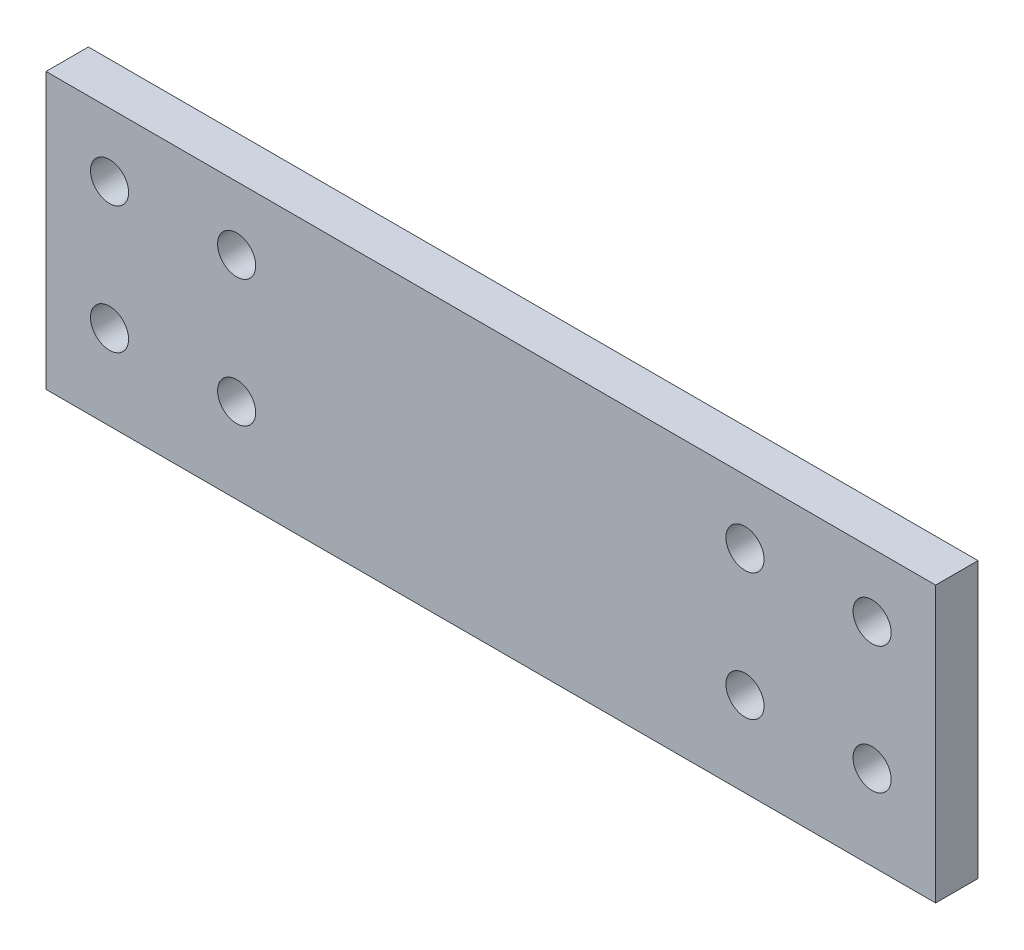
from build123d import *

# Parameters (mm, degrees)
SKETCH1_W           = 210
SKETCH1_H           = 65
BOSS_EXTRUDE1_DEPTH = 10
CUT_EXTRUDE1_REACH  = 112.369
SKETCH2_R           = 4.5


with BuildPart() as part:
    # Sketch1 → Boss-Extrude1 (new body)
    with BuildSketch(Plane.XY):
        Rectangle(SKETCH1_W, SKETCH1_H)
    extrude(amount=BOSS_EXTRUDE1_DEPTH)

    # Sketch2 → Cut-Extrude1 (cut, up to next)
    with BuildSketch(Plane.XY.offset(10), mode=Mode.PRIVATE) as cut_extrude1_sk1:
        with Locations((-90, -12.5)):
            Circle(SKETCH2_R)
    cut_extrude1_tool1 = extrude(cut_extrude1_sk1.sketch, amount=-CUT_EXTRUDE1_REACH, mode=Mode.PRIVATE) & part.part
    # Sketch2 → Cut-Extrude1 (cut, up to next)
    with BuildSketch(Plane.XY.offset(10), mode=Mode.PRIVATE) as cut_extrude1_sk2:
        with Locations((-90, 17.5)):
            Circle(SKETCH2_R)
    cut_extrude1_tool2 = extrude(cut_extrude1_sk2.sketch, amount=-CUT_EXTRUDE1_REACH, mode=Mode.PRIVATE) & part.part
    # Sketch2 → Cut-Extrude1 (cut, up to next)
    with BuildSketch(Plane.XY.offset(10), mode=Mode.PRIVATE) as cut_extrude1_sk3:
        with Locations((-60, 17.5)):
            Circle(SKETCH2_R)
    cut_extrude1_tool3 = extrude(cut_extrude1_sk3.sketch, amount=-CUT_EXTRUDE1_REACH, mode=Mode.PRIVATE) & part.part
    # Sketch2 → Cut-Extrude1 (cut, up to next)
    with BuildSketch(Plane.XY.offset(10), mode=Mode.PRIVATE) as cut_extrude1_sk4:
        with Locations((-60, -12.5)):
            Circle(SKETCH2_R)
    cut_extrude1_tool4 = extrude(cut_extrude1_sk4.sketch, amount=-CUT_EXTRUDE1_REACH, mode=Mode.PRIVATE) & part.part
    # Sketch2 → Cut-Extrude1 (cut, up to next)
    with BuildSketch(Plane.XY.offset(10), mode=Mode.PRIVATE) as cut_extrude1_sk5:
        with Locations((60, 17.5)):
            Circle(SKETCH2_R)
    cut_extrude1_tool5 = extrude(cut_extrude1_sk5.sketch, amount=-CUT_EXTRUDE1_REACH, mode=Mode.PRIVATE) & part.part
    # Sketch2 → Cut-Extrude1 (cut, up to next)
    with BuildSketch(Plane.XY.offset(10), mode=Mode.PRIVATE) as cut_extrude1_sk6:
        with Locations((90, 17.5)):
            Circle(SKETCH2_R)
    cut_extrude1_tool6 = extrude(cut_extrude1_sk6.sketch, amount=-CUT_EXTRUDE1_REACH, mode=Mode.PRIVATE) & part.part
    # Sketch2 → Cut-Extrude1 (cut, up to next)
    with BuildSketch(Plane.XY.offset(10), mode=Mode.PRIVATE) as cut_extrude1_sk7:
        with Locations((60, -12.5)):
            Circle(SKETCH2_R)
    cut_extrude1_tool7 = extrude(cut_extrude1_sk7.sketch, amount=-CUT_EXTRUDE1_REACH, mode=Mode.PRIVATE) & part.part
    # Sketch2 → Cut-Extrude1 (cut, up to next)
    with BuildSketch(Plane.XY.offset(10), mode=Mode.PRIVATE) as cut_extrude1_sk8:
        with Locations((90, -12.5)):
            Circle(SKETCH2_R)
    cut_extrude1_tool8 = extrude(cut_extrude1_sk8.sketch, amount=-CUT_EXTRUDE1_REACH, mode=Mode.PRIVATE) & part.part
    add(cut_extrude1_tool1.solids().sort_by_distance((-90, -12.5, 10))[0], mode=Mode.SUBTRACT)
    add(cut_extrude1_tool2.solids().sort_by_distance((-90, 17.5, 10))[0], mode=Mode.SUBTRACT)
    add(cut_extrude1_tool3.solids().sort_by_distance((-60, 17.5, 10))[0], mode=Mode.SUBTRACT)
    add(cut_extrude1_tool4.solids().sort_by_distance((-60, -12.5, 10))[0], mode=Mode.SUBTRACT)
    add(cut_extrude1_tool5.solids().sort_by_distance((60, 17.5, 10))[0], mode=Mode.SUBTRACT)
    add(cut_extrude1_tool6.solids().sort_by_distance((90, 17.5, 10))[0], mode=Mode.SUBTRACT)
    add(cut_extrude1_tool7.solids().sort_by_distance((60, -12.5, 10))[0], mode=Mode.SUBTRACT)
    add(cut_extrude1_tool8.solids().sort_by_distance((90, -12.5, 10))[0], mode=Mode.SUBTRACT)


solid = part.part
